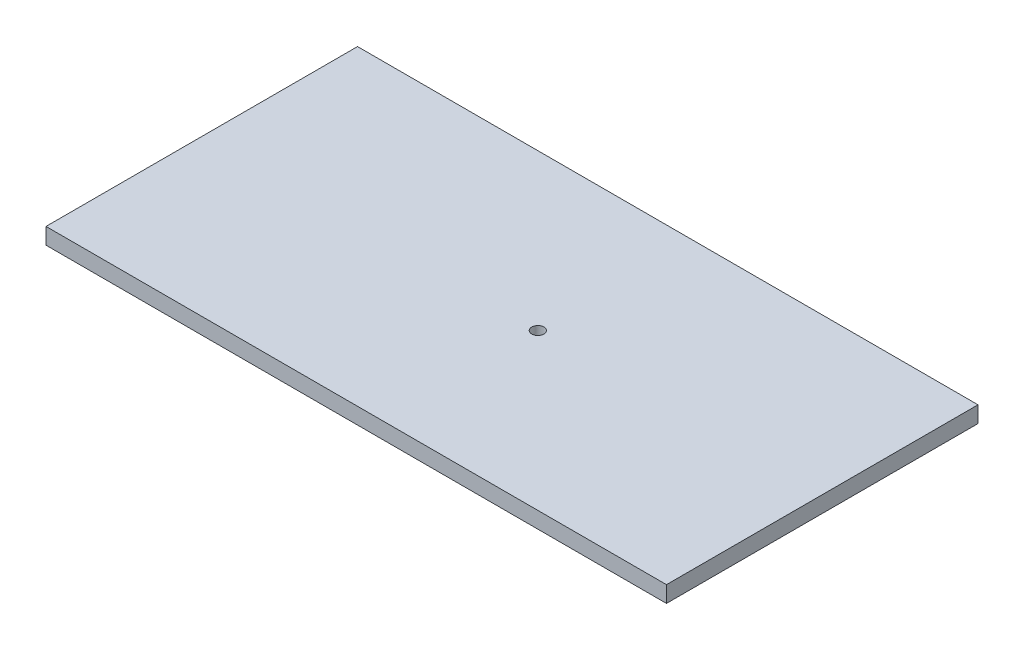
from build123d import *

# Parameters (mm, degrees)
SKETCH1_W           = 60.96
SKETCH1_H           = 30.607
SKETCH1_R           = 0.6
BOSS_EXTRUDE2_DEPTH = 1.6


with BuildPart() as part:
    # Sketch1 → Boss-Extrude2 (new body)
    with BuildSketch(Plane(origin=(0, 0, 0), x_dir=(1, 0, 0), z_dir=(0, 1, 0))):
        Rectangle(SKETCH1_W, SKETCH1_H)
        with Locations(Location((2.54, 0, 0), (0, 0, 270))):
            Circle(SKETCH1_R, mode=Mode.SUBTRACT)
    extrude(amount=BOSS_EXTRUDE2_DEPTH)


solid = part.part
